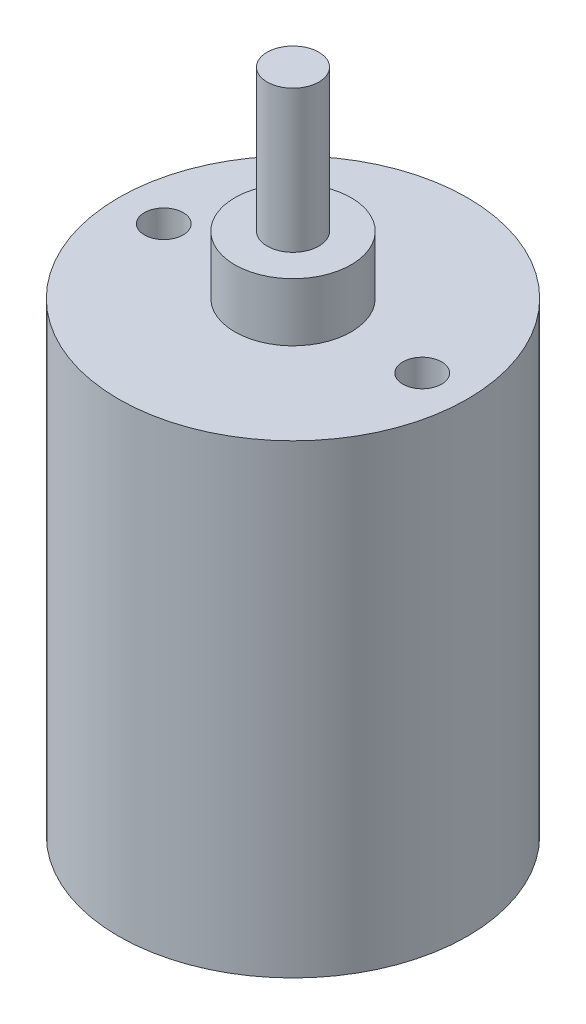
from build123d import *

# Parameters (mm, degrees)
ESQUISSE1_R      = 4.25
EXTRUSION1_DEPTH = 1
ESQUISSE2_R      = 13.5
EXTRUSION2_DEPTH = 36
ESQUISSE3_R      = 4.5
EXTRUSION3_DEPTH = 4.5
ESQUISSE4_R      = 2
EXTRUSION4_DEPTH = 11
ESQUISSE5_R      = 1.5
EXTRUSION5_DEPTH = 4


with BuildPart() as part:
    # Esquisse1 → Extrusion1 (new body)
    with BuildSketch(Plane(origin=(0, 0, 0), x_dir=(1, 0, 0), z_dir=(0, 1, 0))):
        with Locations(Location((0, 0, 0), (0, 0, 270))):
            Circle(ESQUISSE1_R)
    extrude(amount=EXTRUSION1_DEPTH)

    # Esquisse2 → Extrusion2 (add)
    with BuildSketch(Plane(origin=(0, 1, 0), x_dir=(-1, 0, 0), z_dir=(0, 1, 0))):
        with Locations(Location((0, 0, 0), (0, 0, 90))):
            Circle(ESQUISSE2_R)
    extrude(amount=EXTRUSION2_DEPTH)

    # Esquisse3 → Extrusion3 (add)
    with BuildSketch(Plane(origin=(0, 37, 0), x_dir=(-1, 0, 0), z_dir=(0, 1, 0))):
        with Locations(Location((0, 0, 0), (0, 0, 90))):
            Circle(ESQUISSE3_R)
    extrude(amount=EXTRUSION3_DEPTH)

    # Esquisse4 → Extrusion4 (add)
    with BuildSketch(Plane(origin=(0, 41.5, 0), x_dir=(-1, 0, 0), z_dir=(0, 1, 0))):
        with Locations(Location((0, 0, 0), (0, 0, 90))):
            Circle(ESQUISSE4_R)
    extrude(amount=EXTRUSION4_DEPTH)

    # Esquisse5 → Extrusion5 (cut)
    with BuildSketch(Plane(origin=(0, 37, 0), x_dir=(1, 0, 0), z_dir=(0, 1, 0))):
        with Locations(Location((10, 0, 0), (0, 0, 270))):
            Circle(ESQUISSE5_R)
        with Locations(Location((-10, 0, 0), (0, 0, 270))):
            Circle(ESQUISSE5_R)
    extrude(amount=-EXTRUSION5_DEPTH, mode=Mode.SUBTRACT)


solid = part.part
